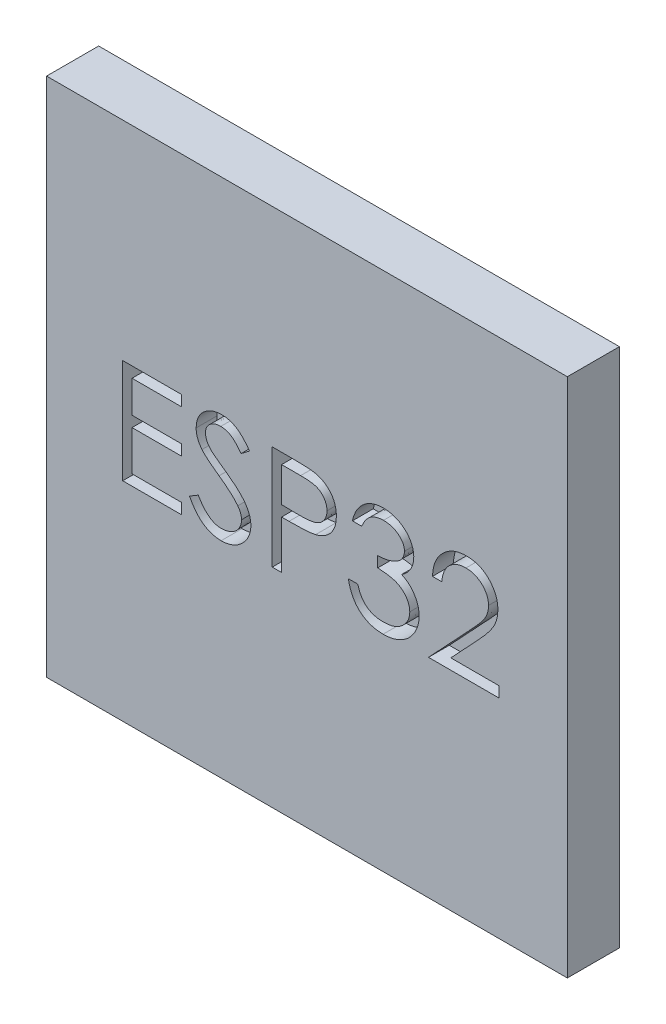
from build123d import *

# Parameters (mm, degrees)
SKETCH1_W           = 50
SKETCH1_H           = 50
BOSS_EXTRUDE1_DEPTH = 5
CUT_EXTRUDE1_DEPTH  = 2


with BuildPart() as part:
    # Sketch1 → Boss-Extrude1 (new body)
    with BuildSketch(Plane.XY):
        Rectangle(SKETCH1_W, SKETCH1_H)
    extrude(amount=BOSS_EXTRUDE1_DEPTH)

    # Sketch2 → Cut-Extrude1 (cut)
    # profile 1 of 5: a face of its own
    with BuildSketch(Plane.XY.offset(5)):
        Polygon((-17.692307692, 5), (-12.051282051, 5), (-12.051282051, 3.974358974), (-16.794871795, 3.974358974), (-16.794871795, 0.897435897), (-12.051282051, 0.897435897), (-12.051282051, -0.128205128), (-16.794871795, -0.128205128), (-16.794871795, -3.974358974), (-12.051282051, -3.974358974), (-12.051282051, -5), (-17.692307692, -5), align=None)
    # profile 2 of 5: a face of its own
    with BuildSketch(Plane.XY.offset(5)):
        with BuildLine():
            Line((-11.282051282, -3.070913462), (-10.436698718, -2.564102564))
            add(Edge.make_bspline(
                [(-10.436698718, -2.564102564), (-10.358075183, -2.695715093), (-10.207435524, -2.947879618), (-9.956145926, -3.288616876), (-9.69576618, -3.578223039), (-9.424368084, -3.815013346), (-9.143608233, -4.001438736), (-8.851653793, -4.133445113), (-8.54948862, -4.215776471), (-8.34384913, -4.225776718), (-8.241185897, -4.230769231)],
                knots=[0, 0, 0, 0, 1.272034388, 2.437168799, 3.508375237, 4.49857839, 5.41946034, 6.295179144, 7.148887113, 8, 8, 8, 8], degree=3))
            add(Edge.make_bspline(
                [(-8.241185897, -4.230769231), (-8.153509153, -4.228327309), (-7.979689802, -4.223486194), (-7.723797679, -4.176969617), (-7.475278244, -4.105506392), (-7.239253565, -4.003160873), (-7.01898038, -3.879336628), (-6.825818393, -3.729776121), (-6.658829499, -3.562329819), (-6.522232028, -3.375522234), (-6.417431928, -3.174616095), (-6.336883161, -2.968399091), (-6.29218295, -2.753631753), (-6.285449369, -2.609030431), (-6.282051282, -2.536057692)],
                knots=[0, 0, 0, 0, 1.095163259, 2.171163733, 3.241058638, 4.321873601, 5.38011039, 6.391990106, 7.366004449, 8.327778327, 9.272591725, 10.192022065, 11.087607919, 12, 12, 12, 12], degree=3))
            add(Edge.make_bspline(
                [(-6.282051282, -2.536057692), (-6.286263598, -2.452798122), (-6.294826622, -2.283543581), (-6.367202279, -2.033830287), (-6.48105727, -1.786708658), (-6.586093395, -1.6338479), (-6.640625, -1.554487179)],
                knots=[0, 0, 0, 0, 0.938893495, 1.908633276, 2.914225137, 4, 4, 4, 4], degree=3))
            add(Edge.make_bspline(
                [(-6.640625, -1.554487179), (-6.685398183, -1.497210541), (-6.779393881, -1.376965402), (-6.940986774, -1.197979015), (-7.130604244, -1.013354961), (-7.341757258, -0.816043369), (-7.582137512, -0.615221093), (-7.844216124, -0.401311728), (-8.134684293, -0.182450079), (-8.33839714, -0.03567132), (-8.443509615, 0.040064103)],
                knots=[0, 0, 0, 0, 0.722233717, 1.516239348, 2.393582979, 3.351407094, 4.387010283, 5.505090956, 6.712668013, 8, 8, 8, 8], degree=3))
            add(Edge.make_bspline(
                [(-8.443509615, 0.040064103), (-8.548721033, 0.115002924), (-8.749877252, 0.258280245), (-9.031187487, 0.470921057), (-9.282743096, 0.665332112), (-9.503426, 0.843343575), (-9.693139134, 1.004979589), (-9.853377451, 1.148687987), (-9.980059043, 1.278355303), (-10.050503559, 1.362473423), (-10.08213141, 1.400240385)],
                knots=[0, 0, 0, 0, 1.452282411, 2.77665338, 3.964542531, 5.026858415, 5.96415736, 6.766646006, 7.446254459, 8, 8, 8, 8], degree=3))
            add(Edge.make_bspline(
                [(-10.08213141, 1.400240385), (-10.126338682, 1.45910049), (-10.213278216, 1.574856786), (-10.328038231, 1.755784951), (-10.425578697, 1.940994281), (-10.502042503, 2.130982466), (-10.566431699, 2.323082262), (-10.609740073, 2.519800107), (-10.63685835, 2.720253303), (-10.639635454, 2.855149019), (-10.641025641, 2.922676282)],
                knots=[0, 0, 0, 0, 1.068054152, 2.10047183, 3.106115577, 4.101338837, 5.06977816, 6.043150881, 7.020423561, 8, 8, 8, 8], degree=3))
            add(Edge.make_bspline(
                [(-10.641025641, 2.922676282), (-10.637296472, 3.028475638), (-10.629917844, 3.237812963), (-10.567516366, 3.543615336), (-10.469022384, 3.835576528), (-10.33103699, 4.110806053), (-10.153158839, 4.362137427), (-9.947313198, 4.592461675), (-9.702137523, 4.786086196), (-9.433130028, 4.955263505), (-9.13868325, 5.087680435), (-8.830137812, 5.187568949), (-8.507003321, 5.244166828), (-8.288137222, 5.252289014), (-8.177083333, 5.256410256)],
                knots=[0, 0, 0, 0, 1.005424448, 1.989358655, 2.955360095, 3.929531133, 4.905563448, 5.876582895, 6.856512386, 7.866279853, 8.892233794, 9.918561126, 10.94386622, 12, 12, 12, 12], degree=3))
            add(Edge.make_bspline(
                [(-8.177083333, 5.256410256), (-8.059243047, 5.252345823), (-7.824896327, 5.244262963), (-7.480184283, 5.173984302), (-7.148296522, 5.057696668), (-6.881315765, 4.925729074), (-6.672365018, 4.793925029), (-6.513014353, 4.673868388), (-6.351535923, 4.535653792), (-6.186627194, 4.378913089), (-6.021082453, 4.202208086), (-5.852444018, 4.006748975), (-5.680317536, 3.793730244), (-5.569586507, 3.641660242), (-5.512820513, 3.563701923)],
                knots=[0, 0, 0, 0, 1.286793592, 2.559021753, 3.825965368, 5.121522368, 5.803751409, 6.523245864, 7.299691795, 8.125521123, 9.008227632, 9.944561021, 10.946284179, 12, 12, 12, 12], degree=3))
            Line((-5.512820513, 3.563701923), (-6.32411859, 2.948717949))
            add(Edge.make_bspline(
                [(-6.32411859, 2.948717949), (-6.373106968, 3.011828493), (-6.467447131, 3.133364645), (-6.610674237, 3.303568404), (-6.745670374, 3.45904406), (-6.878671516, 3.594087282), (-7.00265332, 3.716093378), (-7.122987726, 3.820549826), (-7.237943016, 3.908480098), (-7.382848475, 4.002318841), (-7.564899098, 4.095337423), (-7.793426345, 4.174049074), (-8.032244273, 4.221349251), (-8.194900363, 4.227603216), (-8.27724359, 4.230769231)],
                knots=[0, 0, 0, 0, 1.181633172, 2.275549214, 3.290209073, 4.226197932, 5.078386478, 5.862611352, 6.581680152, 7.217281963, 8.414376989, 9.595101626, 10.782541182, 12, 12, 12, 12], degree=3))
            add(Edge.make_bspline(
                [(-8.27724359, 4.230769231), (-8.380547939, 4.227307231), (-8.579760646, 4.22063109), (-8.862589892, 4.147716847), (-9.117143964, 4.032911531), (-9.335865578, 3.872011594), (-9.517971227, 3.681380186), (-9.649701109, 3.462012029), (-9.728987294, 3.219776593), (-9.738662378, 3.050800432), (-9.743589744, 2.96474359)],
                knots=[0, 0, 0, 0, 1.14458467, 2.207223713, 3.21896685, 4.227309161, 5.202851033, 6.127160689, 7.046193047, 8, 8, 8, 8], degree=3))
            add(Edge.make_bspline(
                [(-9.743589744, 2.96474359), (-9.742466525, 2.911167937), (-9.74021825, 2.803929024), (-9.708861685, 2.64549639), (-9.668577888, 2.487463992), (-9.604741797, 2.330542326), (-9.516612359, 2.171987015), (-9.400883285, 2.009067765), (-9.255130964, 1.840348597), (-9.143482358, 1.730613243), (-9.084535256, 1.672676282)],
                knots=[0, 0, 0, 0, 0.858281714, 1.717966888, 2.583508476, 3.4729293, 4.427298488, 5.488583878, 6.674047936, 8, 8, 8, 8], degree=3))
            add(Edge.make_bspline(
                [(-9.084535256, 1.672676282), (-9.062645621, 1.653141923), (-9.010640858, 1.606732756), (-8.915566784, 1.530754811), (-8.790015932, 1.437032605), (-8.637266786, 1.321068843), (-8.454502895, 1.18655038), (-8.241704163, 1.035197203), (-8.001242641, 0.862095891), (-7.830608596, 0.741074346), (-7.740384615, 0.677083333)],
                knots=[0, 0, 0, 0, 0.420754252, 0.999615792, 1.744751191, 2.668019286, 3.750313428, 4.999500688, 6.413464383, 8, 8, 8, 8], degree=3))
            add(Edge.make_bspline(
                [(-7.740384615, 0.677083333), (-7.631853435, 0.59810802), (-7.421697845, 0.445183272), (-7.122676188, 0.215424187), (-6.851551022, -0.009283724), (-6.60737044, -0.227505458), (-6.387722131, -0.437585724), (-6.195042929, -0.642051953), (-6.027369556, -0.839439304), (-5.846857503, -1.092503806), (-5.662406591, -1.403306904), (-5.504002284, -1.784101871), (-5.404121291, -2.166377072), (-5.391059818, -2.423310891), (-5.384615385, -2.550080128)],
                knots=[0, 0, 0, 0, 1.163667725, 2.253281268, 3.268753668, 4.215851969, 5.092017293, 5.902905408, 6.650798638, 7.335211899, 8.59617414, 9.77448103, 10.901945474, 12, 12, 12, 12], degree=3))
            add(Edge.make_bspline(
                [(-5.384615385, -2.550080128), (-5.386492922, -2.6397326), (-5.390211537, -2.817296553), (-5.432957005, -3.078025344), (-5.495584619, -3.3312564), (-5.589976716, -3.573859579), (-5.70518574, -3.810273186), (-5.85137502, -4.034295759), (-6.020825547, -4.250885469), (-6.215207733, -4.454266873), (-6.427910311, -4.64097029), (-6.652720867, -4.807053323), (-6.890007361, -4.945534247), (-7.138482552, -5.058536653), (-7.398203514, -5.146918131), (-7.669082896, -5.2109549), (-7.951567214, -5.250256932), (-8.14356859, -5.25433625), (-8.241185897, -5.256410256)],
                knots=[0, 0, 0, 0, 0.983748083, 1.948392443, 2.894712957, 3.844097841, 4.80183111, 5.778335162, 6.776009319, 7.81870978, 8.863265674, 9.881300176, 10.883814829, 11.87499822, 12.874611388, 13.892143829, 14.928324115, 16, 16, 16, 16], degree=3))
            add(Edge.make_bspline(
                [(-8.241185897, -5.256410256), (-8.316715449, -5.254949738), (-8.466823335, -5.252047094), (-8.688850426, -5.226386292), (-8.906392109, -5.190080282), (-9.116718629, -5.132440082), (-9.322539805, -5.062505862), (-9.522960475, -4.97639634), (-9.718077772, -4.873204336), (-9.908985152, -4.755218552), (-10.095197079, -4.61791071), (-10.274966988, -4.457986434), (-10.454193232, -4.27985642), (-10.627585793, -4.078683382), (-10.798651919, -3.857717431), (-10.964018804, -3.614891193), (-11.127109426, -3.351527325), (-11.229439334, -3.166198508), (-11.282051282, -3.070913462)],
                knots=[0, 0, 0, 0, 0.915332311, 1.819136955, 2.706846663, 3.586547465, 4.459518054, 5.340707479, 6.227863349, 7.133153174, 8.059268498, 9.028702269, 10.047606654, 11.120612155, 12.245963614, 13.433783089, 14.680604001, 16, 16, 16, 16], degree=3))
        make_face()
    # profile 3 of 5: a face of its own
    with BuildSketch(Plane.XY.offset(5)):
        with BuildLine():
            Line((-3.333333333, 5), (-1.372195513, 5))
            add(Edge.make_bspline(
                [(-1.372195513, 5), (-1.23730721, 4.999851725), (-0.97885523, 4.999567624), (-0.608240785, 4.990954064), (-0.271641552, 4.97944923), (0.030216679, 4.963500963), (0.298262674, 4.944653563), (0.53128353, 4.918219164), (0.731110833, 4.89061832), (0.850843546, 4.862557158), (0.905448718, 4.849759615)],
                knots=[0, 0, 0, 0, 1.415646017, 2.712440637, 3.8905458, 4.950247383, 5.884950622, 6.709939814, 7.411656543, 8, 8, 8, 8], degree=3))
            add(Edge.make_bspline(
                [(0.905448718, 4.849759615), (0.9745731, 4.830839759), (1.111193035, 4.793445868), (1.308053158, 4.718549515), (1.49534986, 4.629743329), (1.673725741, 4.528532072), (1.840988835, 4.410573318), (1.999634667, 4.280648696), (2.148263182, 4.1357585), (2.286038587, 3.977527814), (2.41256658, 3.808612929), (2.521508531, 3.626492272), (2.61272918, 3.434231405), (2.690967098, 3.231964059), (2.747276968, 3.017991706), (2.789696682, 2.793801099), (2.816621332, 2.55941627), (2.81920008, 2.39924522), (2.820512821, 2.317708333)],
                knots=[0, 0, 0, 0, 0.999701418, 1.975846123, 2.934577507, 3.890451536, 4.834027766, 5.787354733, 6.749476667, 7.726910423, 8.712836071, 9.690891519, 10.682875813, 11.679750201, 12.712814741, 13.765529915, 14.8625177, 16, 16, 16, 16], degree=3))
            add(Edge.make_bspline(
                [(2.820512821, 2.317708333), (2.81930875, 2.235486114), (2.816952904, 2.074612788), (2.788677803, 1.839261965), (2.750591542, 1.614352279), (2.692028535, 1.40038242), (2.615326612, 1.198623076), (2.525349318, 1.005990985), (2.416824945, 0.825763351), (2.292125432, 0.657285872), (2.153406591, 0.500400408), (2.001255339, 0.356243853), (1.836285932, 0.225660029), (1.659022652, 0.108356189), (1.467737369, 0.007052534), (1.265331216, -0.083682623), (1.050044884, -0.159885654), (0.901066272, -0.199971543), (0.825320513, -0.220352564)],
                knots=[0, 0, 0, 0, 1.121902311, 2.195077645, 3.232258892, 4.234102512, 5.217864754, 6.176164875, 7.132989551, 8.084763148, 9.034132444, 9.988522005, 10.94243251, 11.903244335, 12.886203696, 13.894208494, 14.929344452, 16, 16, 16, 16], degree=3))
            add(Edge.make_bspline(
                [(0.825320513, -0.220352564), (0.762670987, -0.233675367), (0.625370909, -0.262873065), (0.399248846, -0.295468656), (0.135976314, -0.323290372), (-0.164087343, -0.344150765), (-0.500672785, -0.362008961), (-0.873962092, -0.376203515), (-1.284688027, -0.384003097), (-1.571177295, -0.384405362), (-1.720753205, -0.384615385)],
                knots=[0, 0, 0, 0, 0.601384939, 1.31797006, 2.144135048, 3.087295005, 4.142315834, 5.309527816, 6.595305764, 8, 8, 8, 8], degree=3))
            Line((-1.720753205, -0.384615385), (-2.435897436, -0.384615385))
            Line((-2.435897436, -0.384615385), (-2.435897436, -5))
            Line((-2.435897436, -5), (-3.333333333, -5))
            Line((-3.333333333, -5), (-3.333333333, 5))
        make_face()
        with BuildLine():
            Line((-2.435897436, 3.974358974), (-2.435897436, 0.641025641))
            Line((-2.435897436, 0.641025641), (-0.685096154, 0.618990385))
            add(Edge.make_bspline(
                [(-0.685096154, 0.618990385), (-0.599610652, 0.618946203), (-0.434582652, 0.618860911), (-0.196193442, 0.630247264), (0.02497595, 0.643391643), (0.228246165, 0.662637139), (0.413708835, 0.689840731), (0.581673203, 0.71730284), (0.730836869, 0.757032447), (0.905406017, 0.81052693), (1.099929867, 0.901762975), (1.311551434, 1.034191232), (1.490895966, 1.202993256), (1.6460911, 1.39278706), (1.769250751, 1.603927429), (1.859410729, 1.829838677), (1.912385464, 2.068203962), (1.919488875, 2.23131293), (1.923076923, 2.313701923)],
                knots=[0, 0, 0, 0, 1.160613943, 2.240541288, 3.23993089, 4.169200891, 5.011653406, 5.7853311, 6.478053781, 7.106038997, 8.262395093, 9.384106736, 10.481365981, 11.59014053, 12.70357646, 13.786202915, 14.881775077, 16, 16, 16, 16], degree=3))
            add(Edge.make_bspline(
                [(1.923076923, 2.313701923), (1.919469362, 2.394097676), (1.912297976, 2.553914482), (1.85899551, 2.788139512), (1.769426042, 3.011670096), (1.645264343, 3.220164626), (1.4945754, 3.409275494), (1.31943442, 3.573553), (1.120253673, 3.705615008), (0.934973013, 3.790852956), (0.770398196, 3.8428966), (0.627449739, 3.87931043), (0.466047812, 3.90838359), (0.286139871, 3.931925027), (0.089120345, 3.952077773), (-0.126703412, 3.965751994), (-0.360513821, 3.973756154), (-0.522829738, 3.974153169), (-0.606971154, 3.974358974)],
                knots=[0, 0, 0, 0, 1.120700087, 2.227813068, 3.331159281, 4.466773991, 5.599788987, 6.693661531, 7.80175334, 8.91857717, 9.525282508, 10.207424825, 10.974604443, 11.810962634, 12.737642355, 13.736264703, 14.826523623, 16, 16, 16, 16], degree=3))
            Line((-0.606971154, 3.974358974), (-2.435897436, 3.974358974))
        make_face(mode=Mode.SUBTRACT)
    # profile 4 of 5: a face of its own
    with BuildSketch(Plane.XY.offset(5)):
        with BuildLine():
            Line((5.256410256, 2.692307692), (4.358974359, 2.692307692))
            add(Edge.make_bspline(
                [(4.358974359, 2.692307692), (4.383287361, 2.792971932), (4.430817291, 2.989762288), (4.529953215, 3.27092589), (4.637951087, 3.536993094), (4.767634243, 3.782981876), (4.909087827, 4.013835884), (5.071152745, 4.224319097), (5.246351953, 4.419784712), (5.440137522, 4.593251105), (5.64336227, 4.750330332), (5.858889755, 4.884259067), (6.082383737, 4.999470932), (6.315392688, 5.09438588), (6.558610321, 5.165887377), (6.809837816, 5.217763964), (7.069733531, 5.251452862), (7.246155218, 5.254740756), (7.335737179, 5.256410256)],
                knots=[0, 0, 0, 0, 1.162005537, 2.271625781, 3.343758855, 4.383309926, 5.390229558, 6.379919256, 7.361854164, 8.333198761, 9.295911338, 10.242430842, 11.177959212, 12.116337295, 13.062827104, 14.020064771, 14.994644689, 16, 16, 16, 16], degree=3))
            add(Edge.make_bspline(
                [(7.335737179, 5.256410256), (7.4662593, 5.252469599), (7.724456474, 5.24467424), (8.103779465, 5.173490136), (8.469570377, 5.060846901), (8.817825371, 4.90520768), (9.141306607, 4.713243928), (9.429124283, 4.484773251), (9.677377171, 4.224203819), (9.885646821, 3.936396492), (10.048718247, 3.628809322), (10.168965029, 3.312237445), (10.242169832, 2.987431812), (10.251657137, 2.7681253), (10.256410256, 2.658253205)],
                knots=[0, 0, 0, 0, 1.083050992, 2.142477498, 3.193116406, 4.255571735, 5.30263384, 6.308962982, 7.297363603, 8.282367274, 9.249857812, 10.179914175, 11.08814088, 12, 12, 12, 12], degree=3))
            add(Edge.make_bspline(
                [(10.256410256, 2.658253205), (10.253085711, 2.552519506), (10.24658009, 2.345615065), (10.191340931, 2.043553644), (10.09838018, 1.758863358), (9.96960943, 1.490345752), (9.802919287, 1.239703352), (9.600997296, 1.006372235), (9.362418262, 0.789317498), (9.181621296, 0.664976147), (9.088541667, 0.600961538)],
                knots=[0, 0, 0, 0, 1.024540389, 2.004866551, 2.965041327, 3.920577974, 4.882998113, 5.874504559, 6.905732034, 8, 8, 8, 8], degree=3))
            add(Edge.make_bspline(
                [(9.088541667, 0.600961538), (9.194918108, 0.549595334), (9.405680606, 0.447824027), (9.692967833, 0.248236148), (9.953761763, 0.017789441), (10.09920096, -0.16204671), (10.172275641, -0.252403846)],
                knots=[0, 0, 0, 0, 1.015518401, 2.012035669, 3.001164323, 4, 4, 4, 4], degree=3))
            add(Edge.make_bspline(
                [(10.172275641, -0.252403846), (10.220393762, -0.318283136), (10.315842037, -0.448962898), (10.433657847, -0.659066972), (10.540541031, -0.871499799), (10.623827372, -1.091955244), (10.688324134, -1.317878141), (10.734427084, -1.549656415), (10.763067486, -1.787479336), (10.767169063, -1.948372137), (10.769230769, -2.029246795)],
                knots=[0, 0, 0, 0, 1.025084078, 2.033381695, 3.024893161, 4.013698104, 4.991890475, 5.976764909, 6.982997093, 8, 8, 8, 8], degree=3))
            add(Edge.make_bspline(
                [(10.769230769, -2.029246795), (10.764103588, -2.16927457), (10.753873353, -2.448671146), (10.662433141, -2.861456065), (10.520681025, -3.2649575), (10.319375493, -3.650885613), (10.074039754, -4.011972415), (9.782161685, -4.335047584), (9.447057661, -4.612757882), (9.073327236, -4.844787105), (8.668421154, -5.030266883), (8.235348034, -5.159002434), (7.78034788, -5.242848147), (7.46832703, -5.251839201), (7.309695513, -5.256410256)],
                knots=[0, 0, 0, 0, 0.955779014, 1.907060117, 2.875433937, 3.871313158, 4.872415639, 5.851225146, 6.836215519, 7.83643374, 8.849228613, 9.86973379, 10.916971861, 12, 12, 12, 12], degree=3))
            add(Edge.make_bspline(
                [(7.309695513, -5.256410256), (7.202783226, -5.253929647), (6.992415498, -5.249048635), (6.683148359, -5.215681203), (6.387943504, -5.154738331), (6.106401796, -5.072728887), (5.83827312, -4.968752481), (5.584375677, -4.839270487), (5.34314741, -4.68695191), (5.116864692, -4.509998802), (4.905554499, -4.312052117), (4.71483243, -4.089597802), (4.541518735, -3.846748077), (4.390254053, -3.580682202), (4.254148475, -3.29483861), (4.142202884, -2.985557186), (4.043672688, -2.655602837), (3.99786279, -2.425666437), (3.974358974, -2.307692308)],
                knots=[0, 0, 0, 0, 1.048658725, 2.063410685, 3.046034179, 4.001477787, 4.936774919, 5.862367409, 6.792675028, 7.730719943, 8.675894397, 9.627829632, 10.600096036, 11.597688215, 12.626045268, 13.701542398, 14.82072376, 16, 16, 16, 16], degree=3))
            Line((3.974358974, -2.307692308), (4.871794872, -2.307692308))
            add(Edge.make_bspline(
                [(4.871794872, -2.307692308), (4.895175704, -2.384689488), (4.940653455, -2.534455693), (5.018065735, -2.749999424), (5.106260798, -2.947593861), (5.200873823, -3.128688496), (5.300240811, -3.295066788), (5.411426312, -3.442329271), (5.526195298, -3.576944135), (5.612707736, -3.652785883), (5.655048077, -3.689903846)],
                knots=[0, 0, 0, 0, 1.198163088, 2.33053128, 3.407730985, 4.417276592, 5.372219308, 6.28897303, 7.162600585, 8, 8, 8, 8], degree=3))
            add(Edge.make_bspline(
                [(5.655048077, -3.689903846), (5.711038296, -3.733070514), (5.822845904, -3.819270605), (6.00504085, -3.929275258), (6.19665481, -4.024592473), (6.401839594, -4.097403033), (6.616167509, -4.159053492), (6.843102838, -4.199397832), (7.080643459, -4.227078322), (7.242837069, -4.229520983), (7.325721154, -4.230769231)],
                knots=[0, 0, 0, 0, 0.946170439, 1.889420265, 2.845303464, 3.807233317, 4.801018734, 5.828864929, 6.890507805, 8, 8, 8, 8], degree=3))
            add(Edge.make_bspline(
                [(7.325721154, -4.230769231), (7.41930259, -4.229009501), (7.60229301, -4.225568503), (7.869306894, -4.193923626), (8.123328172, -4.147836731), (8.361536532, -4.07665678), (8.587052267, -3.98871149), (8.796714123, -3.878287474), (8.993274426, -3.748731127), (9.174215585, -3.601476388), (9.336917035, -3.440272116), (9.480172787, -3.271663341), (9.601957534, -3.096360971), (9.700196329, -2.913394912), (9.77776933, -2.723522829), (9.830578474, -2.526211888), (9.867297089, -2.323076842), (9.870287409, -2.184994073), (9.871794872, -2.115384615)],
                knots=[0, 0, 0, 0, 1.217147791, 2.380027433, 3.494444702, 4.572153297, 5.609568379, 6.639424714, 7.649109417, 8.668170816, 9.669597737, 10.625200337, 11.543417969, 12.441394052, 13.322311151, 14.205496177, 15.095365482, 16, 16, 16, 16], degree=3))
            add(Edge.make_bspline(
                [(9.871794872, -2.115384615), (9.867422582, -2.022209361), (9.858699757, -1.836322481), (9.792103816, -1.562843697), (9.682564204, -1.299348233), (9.529214172, -1.05033169), (9.342540661, -0.8195434), (9.124355213, -0.613624878), (8.872845989, -0.443710333), (8.641360649, -0.326314171), (8.436317345, -0.246208242), (8.260844818, -0.192851201), (8.06439738, -0.147669328), (7.849350669, -0.105634266), (7.614084336, -0.069858986), (7.358854513, -0.040025226), (7.08360948, -0.016153681), (6.893063292, -0.005493409), (6.794871795, 0)],
                knots=[0, 0, 0, 0, 1.07054697, 2.135767047, 3.216561865, 4.33974944, 5.486079747, 6.621378074, 7.775625952, 8.963672916, 9.598146892, 10.304877434, 11.070270905, 11.915000392, 12.823868403, 13.805723172, 14.86925407, 16, 16, 16, 16], degree=3))
            Line((6.794871795, 0), (6.794871795, 1.025641026))
            add(Edge.make_bspline(
                [(6.794871795, 1.025641026), (6.918589411, 1.027740465), (7.16092183, 1.031852751), (7.514905558, 1.081589923), (7.853400735, 1.150391718), (8.168905713, 1.255777981), (8.456473465, 1.378178829), (8.705958042, 1.520613714), (8.913864177, 1.678941569), (9.079181525, 1.855606167), (9.203550749, 2.045077731), (9.294484456, 2.242553896), (9.348199674, 2.449765498), (9.355370151, 2.591178835), (9.358974359, 2.662259615)],
                knots=[0, 0, 0, 0, 1.321986639, 2.589447074, 3.816329219, 5.01088745, 6.139805852, 7.153945165, 8.075214402, 8.924034688, 9.728124013, 10.488707548, 11.240355623, 12, 12, 12, 12], degree=3))
            add(Edge.make_bspline(
                [(9.358974359, 2.662259615), (9.357790328, 2.714481744), (9.355434754, 2.818375193), (9.325728246, 2.970161104), (9.281088128, 3.117306664), (9.219717473, 3.259186121), (9.137574048, 3.394815475), (9.03927123, 3.525351044), (8.922219515, 3.650047555), (8.788089666, 3.76627704), (8.644055938, 3.877046289), (8.486199437, 3.971085252), (8.319279795, 4.051499715), (8.14311221, 4.117812578), (7.957124981, 4.167696258), (7.762191959, 4.203512948), (7.557941434, 4.225906247), (7.418593629, 4.229130293), (7.34775641, 4.230769231)],
                knots=[0, 0, 0, 0, 0.884392785, 1.759457502, 2.611959086, 3.489218968, 4.37281399, 5.2945488, 6.255912374, 7.266815255, 8.301784654, 9.332968512, 10.37626691, 11.440494194, 12.520033166, 13.637162961, 14.798855837, 16, 16, 16, 16], degree=3))
            add(Edge.make_bspline(
                [(7.34775641, 4.230769231), (7.233894502, 4.226793911), (7.011495712, 4.219029186), (6.690881664, 4.151020576), (6.392826424, 4.042511766), (6.165001662, 3.912988854), (5.996765736, 3.785130471), (5.876545912, 3.67346651), (5.758487311, 3.549372728), (5.650356806, 3.405205942), (5.541002587, 3.250729398), (5.441446697, 3.078090308), (5.344704719, 2.891792039), (5.28641172, 2.760090226), (5.256410256, 2.692307692)],
                knots=[0, 0, 0, 0, 1.472543308, 2.876219568, 4.221790263, 5.565193594, 6.249813518, 6.953379497, 7.687249741, 8.463570142, 9.283606569, 10.136032583, 11.040678096, 12, 12, 12, 12], degree=3))
        make_face()
    # profile 5 of 5: a face of its own
    with BuildSketch(Plane.XY.offset(5)):
        with BuildLine():
            Line((12.948717949, 1.923076923), (12.051282051, 1.923076923))
            add(Edge.make_bspline(
                [(12.051282051, 1.923076923), (12.05713106, 2.042136602), (12.068618357, 2.275966644), (12.122413469, 2.616892091), (12.199387404, 2.942762944), (12.30822013, 3.250962699), (12.443380924, 3.544216434), (12.605466716, 3.821359336), (12.797449146, 4.08133416), (13.015182672, 4.321730856), (13.251664498, 4.542266772), (13.506824325, 4.732710323), (13.774952974, 4.893617955), (14.055236971, 5.028135789), (14.350838581, 5.129106778), (14.659075318, 5.204025748), (14.981301422, 5.249101021), (15.200844342, 5.253946123), (15.3125, 5.256410256)],
                knots=[0, 0, 0, 0, 1.10065271, 2.161652631, 3.183658789, 4.190468796, 5.17591951, 6.163126047, 7.15150782, 8.156236427, 9.156009102, 10.134482811, 11.092018607, 12.041330605, 13.001268258, 13.972401359, 14.968799086, 16, 16, 16, 16], degree=3))
            add(Edge.make_bspline(
                [(15.3125, 5.256410256), (15.42215164, 5.253843238), (15.637613196, 5.248799139), (15.952076095, 5.205481912), (16.251439793, 5.137637364), (16.535119126, 5.042450461), (16.800850739, 4.914494954), (17.050630867, 4.760787701), (17.287433183, 4.583016754), (17.500595422, 4.373720144), (17.696332791, 4.15028476), (17.865196377, 3.911747892), (18.009805416, 3.665378505), (18.130341644, 3.409297929), (18.21907347, 3.14109499), (18.286439778, 2.864674411), (18.324518103, 2.577174951), (18.33036217, 2.382584792), (18.333333333, 2.283653846)],
                knots=[0, 0, 0, 0, 1.111607364, 2.184268762, 3.212621178, 4.221274766, 5.211760367, 6.196651075, 7.1921475, 8.207485113, 9.220403448, 10.201281604, 11.166441695, 12.114753415, 13.065576456, 14.026450734, 14.996634279, 16, 16, 16, 16], degree=3))
            add(Edge.make_bspline(
                [(18.333333333, 2.283653846), (18.328514348, 2.144368677), (18.318960943, 1.868242596), (18.236516078, 1.461944432), (18.109138659, 1.067929977), (17.954644289, 0.75084697), (17.798585524, 0.496627276), (17.660928965, 0.28543973), (17.496207958, 0.060221397), (17.305929634, -0.181296058), (17.092964473, -0.4398514), (16.855779708, -0.715550732), (16.59256345, -1.00546589), (16.407825787, -1.203482498), (16.312099359, -1.306089744)],
                knots=[0, 0, 0, 0, 1.184203166, 2.347625244, 3.513805382, 4.700623107, 5.337941753, 6.051866363, 6.845199593, 7.711357327, 8.668078039, 9.695487809, 10.805859518, 12, 12, 12, 12], degree=3))
            Line((16.312099359, -1.306089744), (13.810096154, -3.974358974))
            Line((13.810096154, -3.974358974), (18.461538462, -3.974358974))
            Line((18.461538462, -3.974358974), (18.461538462, -5))
            Line((18.461538462, -5), (11.666666667, -5))
            Line((11.666666667, -5), (15.544871795, -0.861378205))
            add(Edge.make_bspline(
                [(15.544871795, -0.861378205), (15.639294329, -0.762811615), (15.820660692, -0.573485368), (16.07718234, -0.29707691), (16.307579449, -0.040649651), (16.513343429, 0.195311916), (16.690010587, 0.414259253), (16.846788392, 0.609101263), (16.972404367, 0.788399693), (17.108734069, 0.996230018), (17.240774015, 1.249979496), (17.35423789, 1.560075751), (17.423423171, 1.879296473), (17.431722701, 2.095016578), (17.435897436, 2.203525641)],
                knots=[0, 0, 0, 0, 1.329631726, 2.553950428, 3.673215718, 4.687767853, 5.603093632, 6.413772471, 7.123043292, 7.734684054, 8.834405432, 9.900288307, 10.943827018, 12, 12, 12, 12], degree=3))
            add(Edge.make_bspline(
                [(17.435897436, 2.203525641), (17.434081029, 2.271758208), (17.430501241, 2.406231495), (17.398907819, 2.603390806), (17.351163516, 2.793575988), (17.282748493, 2.977372043), (17.192443522, 3.152931049), (17.082519579, 3.320466707), (16.955690826, 3.482435179), (16.808972914, 3.634301745), (16.647797143, 3.773390903), (16.477527859, 3.896602576), (16.297384704, 3.999571464), (16.108127212, 4.083981456), (15.910283013, 4.150196831), (15.703469456, 4.196078486), (15.488257981, 4.224885583), (15.341305136, 4.228783217), (15.266426282, 4.230769231)],
                knots=[0, 0, 0, 0, 0.991446411, 1.95395049, 2.89581595, 3.838931463, 4.798493298, 5.75982156, 6.748411868, 7.785213223, 8.824556874, 9.840280684, 10.836137867, 11.835679398, 12.848801643, 13.863922112, 14.911575587, 16, 16, 16, 16], degree=3))
            add(Edge.make_bspline(
                [(15.266426282, 4.230769231), (15.188223903, 4.228726281), (15.034647342, 4.224714266), (14.809164391, 4.196649512), (14.594062169, 4.148232825), (14.38879959, 4.082013755), (14.193029344, 3.997846473), (14.007703504, 3.893012917), (13.833238106, 3.767917222), (13.669305182, 3.626087061), (13.518265242, 3.468179629), (13.385559883, 3.292151163), (13.269605557, 3.101215691), (13.168436318, 2.895888403), (13.086277204, 2.674306175), (13.023496774, 2.43725559), (12.973820069, 2.185765928), (12.957224296, 2.012094257), (12.948717949, 1.923076923)],
                knots=[0, 0, 0, 0, 1.031018746, 2.02475058, 2.990194455, 3.934040569, 4.864654155, 5.795059489, 6.735614925, 7.690564532, 8.649604399, 9.611025574, 10.590972636, 11.591080095, 12.624614302, 13.701020113, 14.821632451, 16, 16, 16, 16], degree=3))
        make_face()
    extrude(amount=-CUT_EXTRUDE1_DEPTH, mode=Mode.SUBTRACT)


solid = part.part
